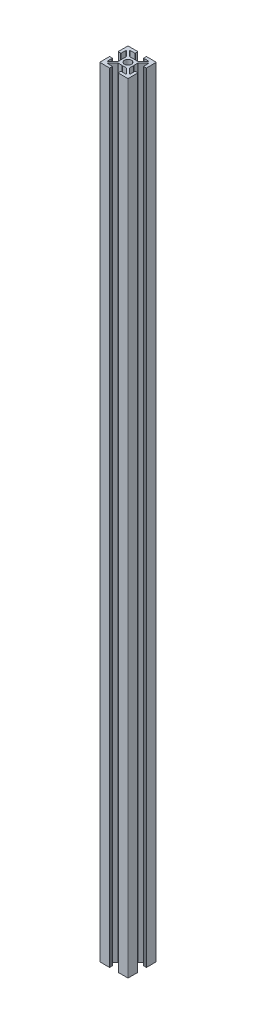
from build123d import *

# Parameters (mm, degrees)
SKETCH1_R           = 2.5
BOSS_EXTRUDE1_DEPTH = 700
SKETCH3_W           = 24.985840616
SKETCH3_H           = 22.156024638
CUT_EXTRUDE2_DEPTH  = 150


with BuildPart() as part:
    # Sketch1 → Boss-Extrude1 (new body)
    with BuildSketch(Plane(origin=(0, 0, 0), x_dir=(1, 0, 0), z_dir=(0, 1, 0))):
        with BuildLine():
            Line((-2.997918472, 4.058578644), (-6.597918472, 7.658578644))
            ThreePointArc((-6.597918472, 7.658578644), (-6.621415508, 7.686854412), (-6.639339828, 7.718953455))
            ThreePointArc((-6.639339828, 7.718953455), (-6.656497116, 7.8), (-6.639339828, 7.881046545))
            ThreePointArc((-6.639339828, 7.881046545), (-6.565562901, 7.967644429), (-6.456497116, 8))
            Line((-6.456497116, 8), (-3.2, 8))
            ThreePointArc((-3.2, 8), (-3.058578644, 8.058578644), (-3, 8.2))
            Line((-3, 8.2), (-3, 9.8))
            ThreePointArc((-3, 9.8), (-3.058578644, 9.941421356), (-3.2, 10))
            Line((-3.2, 10), (-9.8, 10))
            ThreePointArc((-9.8, 10), (-9.941421356, 9.941421356), (-10, 9.8))
            Line((-10, 9.8), (-10, 3.2))
            ThreePointArc((-10, 3.2), (-9.941421356, 3.058578644), (-9.8, 3))
            Line((-9.8, 3), (-8.2, 3))
            ThreePointArc((-8.2, 3), (-8.058578644, 3.058578644), (-8, 3.2))
            Line((-8, 3.2), (-8, 6.456497116))
            ThreePointArc((-8, 6.456497116), (-7.967644429, 6.565562901), (-7.881046545, 6.639339828))
            ThreePointArc((-7.881046545, 6.639339828), (-7.8, 6.656497116), (-7.718953455, 6.639339828))
            ThreePointArc((-7.718953455, 6.639339828), (-7.686854412, 6.621415508), (-7.658578644, 6.597918472))
            Line((-7.658578644, 6.597918472), (-4.058578644, 2.997918472))
            ThreePointArc((-4.058578644, 2.997918472), (-4.015224093, 2.933033802), (-4, 2.856497116))
            Line((-4, 2.856497116), (-4, 0.130901699))
            ThreePointArc((-4, 0.130901699), (-3.99253254, 0.104615144), (-3.97236068, 0.08618034))
            Line((-3.97236068, 0.08618034), (-3.8, 0))
            Line((-3.8, 0), (-3.97236068, -0.08618034))
            ThreePointArc((-3.97236068, -0.08618034), (-3.99253254, -0.104615144), (-4, -0.130901699))
            Line((-4, -0.130901699), (-4, -2.856497116))
            ThreePointArc((-4, -2.856497116), (-4.015224093, -2.933033802), (-4.058578644, -2.997918472))
            Line((-4.058578644, -2.997918472), (-7.658578644, -6.597918472))
            ThreePointArc((-7.658578644, -6.597918472), (-7.686854412, -6.621415508), (-7.718953455, -6.639339828))
            ThreePointArc((-7.718953455, -6.639339828), (-7.8, -6.656497116), (-7.881046545, -6.639339828))
            ThreePointArc((-7.881046545, -6.639339828), (-7.967644429, -6.565562901), (-8, -6.456497116))
            Line((-8, -6.456497116), (-8, -3.2))
            ThreePointArc((-8, -3.2), (-8.058578644, -3.058578644), (-8.2, -3))
            Line((-8.2, -3), (-9.8, -3))
            ThreePointArc((-9.8, -3), (-9.941421356, -3.058578644), (-10, -3.2))
            Line((-10, -3.2), (-10, -9.8))
            ThreePointArc((-10, -9.8), (-9.941421356, -9.941421356), (-9.8, -10))
            Line((-9.8, -10), (-3.2, -10))
            ThreePointArc((-3.2, -10), (-3.058578644, -9.941421356), (-3, -9.8))
            Line((-3, -9.8), (-3, -8.2))
            ThreePointArc((-3, -8.2), (-3.058578644, -8.058578644), (-3.2, -8))
            Line((-3.2, -8), (-6.456497116, -8))
            ThreePointArc((-6.456497116, -8), (-6.565562901, -7.967644429), (-6.639339828, -7.881046545))
            ThreePointArc((-6.639339828, -7.881046545), (-6.656497116, -7.8), (-6.639339828, -7.718953455))
            ThreePointArc((-6.639339828, -7.718953455), (-6.621415508, -7.686854412), (-6.597918472, -7.658578644))
            Line((-6.597918472, -7.658578644), (-2.997918472, -4.058578644))
            ThreePointArc((-2.997918472, -4.058578644), (-2.933033802, -4.015224093), (-2.856497116, -4))
            Line((-2.856497116, -4), (-0.211803399, -4))
            ThreePointArc((-0.211803399, -4), (-0.200315753, -3.998662449), (-0.189442719, -3.99472136))
            Line((-0.189442719, -3.99472136), (0, -3.9))
            Line((0, -3.9), (0.189442719, -3.99472136))
            ThreePointArc((0.189442719, -3.99472136), (0.200315753, -3.998662449), (0.211803399, -4))
            Line((0.211803399, -4), (2.856497116, -4))
            ThreePointArc((2.856497116, -4), (2.933033802, -4.015224093), (2.997918472, -4.058578644))
            Line((2.997918472, -4.058578644), (6.597918472, -7.658578644))
            ThreePointArc((6.597918472, -7.658578644), (6.621415508, -7.686854412), (6.639339828, -7.718953455))
            ThreePointArc((6.639339828, -7.718953455), (6.656497116, -7.8), (6.639339828, -7.881046545))
            ThreePointArc((6.639339828, -7.881046545), (6.565562901, -7.967644429), (6.456497116, -8))
            Line((6.456497116, -8), (3.2, -8))
            ThreePointArc((3.2, -8), (3.058578644, -8.058578644), (3, -8.2))
            Line((3, -8.2), (3, -9.8))
            ThreePointArc((3, -9.8), (3.058578644, -9.941421356), (3.2, -10))
            Line((3.2, -10), (9.8, -10))
            ThreePointArc((9.8, -10), (9.941421356, -9.941421356), (10, -9.8))
            Line((10, -9.8), (10, -3.2))
            ThreePointArc((10, -3.2), (9.941421356, -3.058578644), (9.8, -3))
            Line((9.8, -3), (8.2, -3))
            ThreePointArc((8.2, -3), (8.058578644, -3.058578644), (8, -3.2))
            Line((8, -3.2), (8, -6.456497116))
            ThreePointArc((8, -6.456497116), (7.967644429, -6.565562901), (7.881046545, -6.639339828))
            ThreePointArc((7.881046545, -6.639339828), (7.8, -6.656497116), (7.718953455, -6.639339828))
            ThreePointArc((7.718953455, -6.639339828), (7.686854412, -6.621415508), (7.658578644, -6.597918472))
            Line((7.658578644, -6.597918472), (4.058578644, -2.997918472))
            ThreePointArc((4.058578644, -2.997918472), (4.015224093, -2.933033802), (4, -2.856497116))
            Line((4, -2.856497116), (4, -0.130901699))
            ThreePointArc((4, -0.130901699), (3.99253254, -0.104615144), (3.97236068, -0.08618034))
            Line((3.97236068, -0.08618034), (3.8, 0))
            Line((3.8, 0), (3.97236068, 0.08618034))
            ThreePointArc((3.97236068, 0.08618034), (3.99253254, 0.104615144), (4, 0.130901699))
            Line((4, 0.130901699), (4, 2.856497116))
            ThreePointArc((4, 2.856497116), (4.015224093, 2.933033802), (4.058578644, 2.997918472))
            Line((4.058578644, 2.997918472), (7.658578644, 6.597918472))
            ThreePointArc((7.658578644, 6.597918472), (7.686854412, 6.621415508), (7.718953455, 6.639339828))
            ThreePointArc((7.718953455, 6.639339828), (7.8, 6.656497116), (7.881046545, 6.639339828))
            ThreePointArc((7.881046545, 6.639339828), (7.967644429, 6.565562901), (8, 6.456497116))
            Line((8, 6.456497116), (8, 3.2))
            ThreePointArc((8, 3.2), (8.058578644, 3.058578644), (8.2, 3))
            Line((8.2, 3), (9.8, 3))
            ThreePointArc((9.8, 3), (9.941421356, 3.058578644), (10, 3.2))
            Line((10, 3.2), (10, 9.8))
            ThreePointArc((10, 9.8), (9.941421356, 9.941421356), (9.8, 10))
            Line((9.8, 10), (3.2, 10))
            ThreePointArc((3.2, 10), (3.058578644, 9.941421356), (3, 9.8))
            Line((3, 9.8), (3, 8.2))
            ThreePointArc((3, 8.2), (3.058578644, 8.058578644), (3.2, 8))
            Line((3.2, 8), (6.456497116, 8))
            ThreePointArc((6.456497116, 8), (6.565562901, 7.967644429), (6.639339828, 7.881046545))
            ThreePointArc((6.639339828, 7.881046545), (6.656497116, 7.8), (6.639339828, 7.718953455))
            ThreePointArc((6.639339828, 7.718953455), (6.621415508, 7.686854412), (6.597918472, 7.658578644))
            Line((6.597918472, 7.658578644), (2.997918472, 4.058578644))
            ThreePointArc((2.997918472, 4.058578644), (2.933033802, 4.015224093), (2.856497116, 4))
            Line((2.856497116, 4), (0.211803399, 4))
            ThreePointArc((0.211803399, 4), (0.200315753, 3.998662449), (0.189442719, 3.99472136))
            Line((0.189442719, 3.99472136), (0, 3.9))
            Line((0, 3.9), (-0.189442719, 3.99472136))
            ThreePointArc((-0.189442719, 3.99472136), (-0.200315753, 3.998662449), (-0.211803399, 4))
            Line((-0.211803399, 4), (-2.856497116, 4))
            ThreePointArc((-2.856497116, 4), (-2.933033802, 4.015224093), (-2.997918472, 4.058578644))
        make_face()
        Circle(SKETCH1_R, mode=Mode.SUBTRACT)
    extrude(amount=BOSS_EXTRUDE1_DEPTH)

    # Sketch3 → Cut-Extrude2 (cut)
    with BuildSketch(Plane(origin=(0, 700, 0), x_dir=(1, 0, 0), z_dir=(0, 1, 0))):
        Rectangle(SKETCH3_W, SKETCH3_H)
    extrude(amount=-CUT_EXTRUDE2_DEPTH, mode=Mode.SUBTRACT)


solid = part.part
